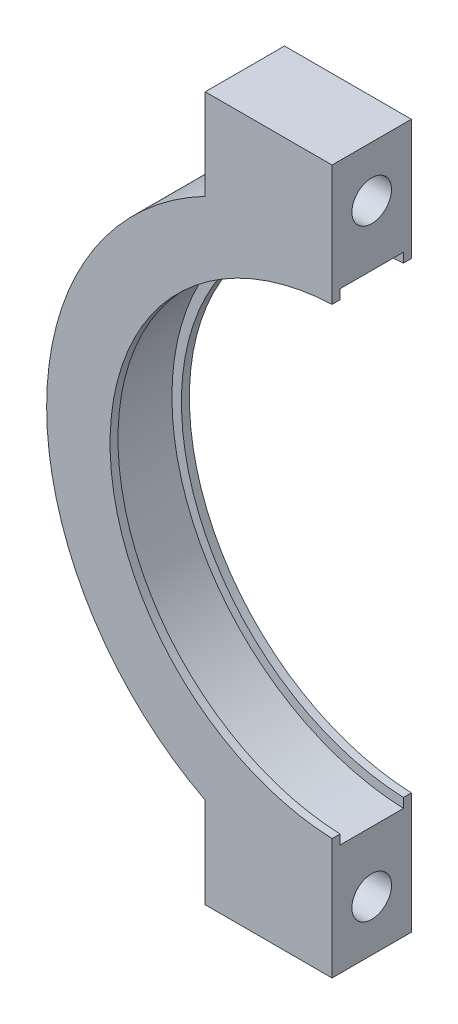
from build123d import *

# Parameters (mm, degrees)
BOSS_EXTRUDE1_DEPTH = 25
SKETCH2_R           = 6.25
CUT_EXTRUDE1_DEPTH  = 146.07239572
CUT_EXTRUDE2_START  = 2.5
CUT_EXTRUDE2_DEPTH  = 20


with BuildPart() as part:
    # Sketch1 → Boss-Extrude1 (new body)
    with BuildSketch(Plane.XY):
        with BuildLine():
            Line((-3, 111), (-43, 111))
            Line((-43, 111), (-43, 82.462112512))
            ThreePointArc((-43, 82.462112512), (-93, 0), (-43, -82.462112512))
            Line((-43, -82.462112512), (-43, -111))
            Line((-43, -111), (-3, -111))
            Line((-3, -111), (-3, -72.938330115))
            ThreePointArc((-3, -72.938330115), (-73, 0), (-3, 72.938330115))
            Line((-3, 72.938330115), (-3, 111))
        make_face()
    extrude(amount=BOSS_EXTRUDE1_DEPTH)

    # Sketch2 → Cut-Extrude1 (cut, through all)
    with BuildSketch(Plane(origin=(-3, 0, 0), x_dir=(0, 0, -1), z_dir=(1, 0, 0))):
        with Locations((-12.5, 95)):
            Circle(SKETCH2_R)
        with Locations((-12.5, -95)):
            Circle(SKETCH2_R)
    extrude(amount=-CUT_EXTRUDE1_DEPTH, mode=Mode.SUBTRACT)

    # Sketch1<3> → Cut-Extrude2 (cut)
    with BuildSketch(Plane.XY.offset(CUT_EXTRUDE2_START)):
        with BuildLine():
            Line((-3, 72.938330115), (-3, 75.940766391))
            ThreePointArc((-3, 75.940766391), (-76, 0), (-3, -75.940766391))
            Line((-3, -75.940766391), (-3, -72.938330115))
            ThreePointArc((-3, -72.938330115), (-73, 0), (-3, 72.938330115))
        make_face()
    extrude(amount=CUT_EXTRUDE2_DEPTH, mode=Mode.SUBTRACT)


solid = part.part
